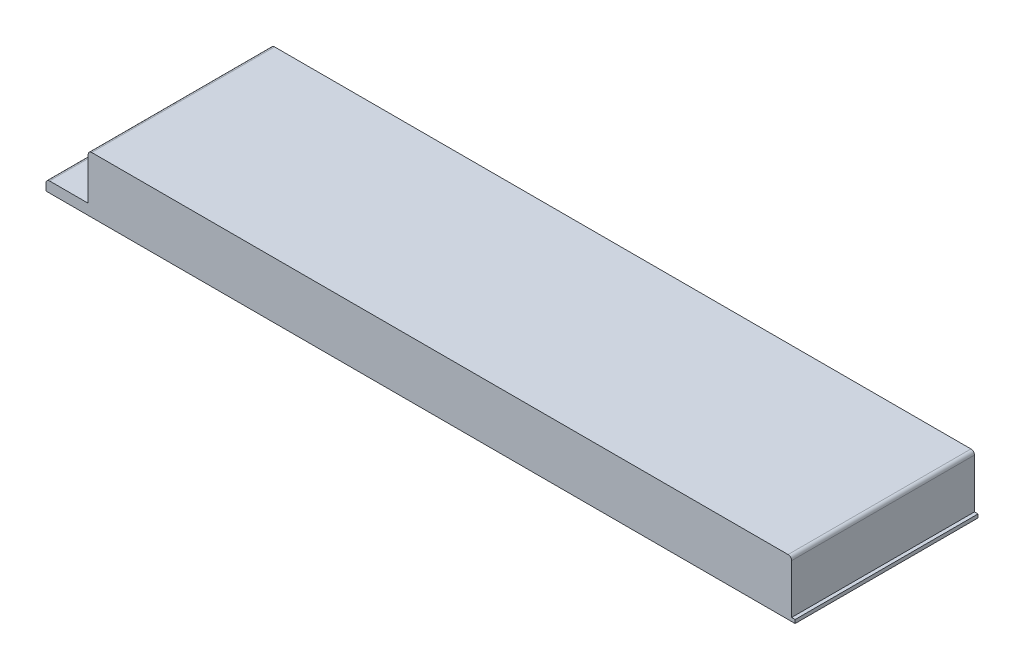
from build123d import *

# Parameters (mm, degrees)
SKETCH1_W                                           = 107
SKETCH1_H                                           = 26
BOSS_EXTRUDE1_DEPTH                                 = 8
SKETCH2_W                                           = 1
SKETCH2_H                                           = 7.5
SKETCH2_W_2                                         = 6
SKETCH2_H_2                                         = 6.5
CUT_EXTRUDE1_DEPTH                                  = 111.403804282
FILLET1_R                                           = 0.5
CSK_FOR_M2_COUNTERSUNK_FLAT_HEAD_SCREW1_D           = 2.4
CSK_FOR_M2_COUNTERSUNK_FLAT_HEAD_SCREW1_DEPTH       = 15
CSK_FOR_M2_COUNTERSUNK_FLAT_HEAD_SCREW1_CSINK_D     = 4.4
CSK_FOR_M2_COUNTERSUNK_FLAT_HEAD_SCREW1_CSINK_ANGLE = 90
CSK_FOR_M2_COUNTERSUNK_FLAT_HEAD_SCREW1_TIP         = 0.721032743
SKETCH14_W                                          = 97
SKETCH14_H                                          = 24
CUT_EXTRUDE7_DEPTH                                  = 111.403804282
SKETCH14_3_W                                        = 97
SKETCH14_3_H                                        = 24
BOSS_EXTRUDE3_DEPTH                                 = 1
SKETCH18_W                                          = 97
SKETCH18_H                                          = 24
CUT_EXTRUDE8_DEPTH                                  = 111.403804282
SKETCH20_W                                          = 97
SKETCH20_H                                          = 24
SKETCH20_W_2                                        = 93
SKETCH20_H_2                                        = 20
BOSS_EXTRUDE4_DEPTH                                 = 8
SKETCH20_2_W                                        = 97
SKETCH20_2_H                                        = 24
SKETCH20_2_W_2                                      = 93
SKETCH20_2_H_2                                      = 20
CUT_EXTRUDE9_DEPTH                                  = 3
SKETCH21_W                                          = 52
SKETCH21_H                                          = 2
BOSS_EXTRUDE5_DEPTH                                 = 5
SKETCH22_W                                          = 52
SKETCH22_H                                          = 2
BOSS_EXTRUDE6_DEPTH                                 = 5
SKETCH23_W                                          = 0.5
SKETCH23_H                                          = 16.612240618
CUT_EXTRUDE10_DEPTH                                 = 111.403804282
BOSS_EXTRUDE7_REACH                                 = 111.249
SKETCH25_W                                          = 2
SKETCH25_H                                          = 5
CUT_EXTRUDE11_REACH                                 = 64.258
SKETCH26_W                                          = 10
SKETCH26_H                                          = 2
SKETCH27_W                                          = 97
SKETCH27_H                                          = 24
BOSS_EXTRUDE8_DEPTH                                 = 3
SKETCH29_W                                          = 20
SKETCH29_H                                          = 5
CUT_EXTRUDE12_DEPTH                                 = 54


with BuildPart() as part:
    # Sketch1 → Boss-Extrude1 (new body)
    with BuildSketch(Plane(origin=(0, 0, 0), x_dir=(1, 0, 0), z_dir=(0, 1, 0))):
        with Locations((53.5, -13)):
            Rectangle(SKETCH1_W, SKETCH1_H)
    extrude(amount=BOSS_EXTRUDE1_DEPTH)

    # Sketch2 → Cut-Extrude1 (cut, through all)
    with BuildSketch(Plane.XY.offset(26)):
        with Locations((106.5, 4.25)):
            Rectangle(SKETCH2_W, SKETCH2_H)
        with Locations((3, 4.75)):
            Rectangle(SKETCH2_W_2, SKETCH2_H_2)
    extrude(amount=-CUT_EXTRUDE1_DEPTH, mode=Mode.SUBTRACT)

    # Fillet1
    fillet1_edges = [part.edges().sort_by_distance(p)[0] for p in [
        (106, 8, 13),
        (0, 1.5, 13),
        (6, 8, 13),
    ]]
    fillet(fillet1_edges, radius=FILLET1_R)

    # CSK for M2 Countersunk Flat Head Screw1
    with Locations(Plane(origin=(3, 1.5, 13), x_dir=(1, 0, 0), z_dir=(0, 1, 0))):
        with Locations((0, 0)):
            CounterSinkHole(CSK_FOR_M2_COUNTERSUNK_FLAT_HEAD_SCREW1_D / 2, CSK_FOR_M2_COUNTERSUNK_FLAT_HEAD_SCREW1_CSINK_D / 2, depth=CSK_FOR_M2_COUNTERSUNK_FLAT_HEAD_SCREW1_DEPTH, counter_sink_angle=CSK_FOR_M2_COUNTERSUNK_FLAT_HEAD_SCREW1_CSINK_ANGLE)
            with Locations((0, 0, -(CSK_FOR_M2_COUNTERSUNK_FLAT_HEAD_SCREW1_DEPTH + CSK_FOR_M2_COUNTERSUNK_FLAT_HEAD_SCREW1_TIP / 2))):  # 118° drill point
                Cone(0, CSK_FOR_M2_COUNTERSUNK_FLAT_HEAD_SCREW1_D / 2, CSK_FOR_M2_COUNTERSUNK_FLAT_HEAD_SCREW1_TIP, mode=Mode.SUBTRACT)

    # Sketch14 → Cut-Extrude7 (cut, through all)
    with BuildSketch(Plane(origin=(0, 8, 0), x_dir=(1, 0, 0), z_dir=(0, 1, 0))):
        with Locations((56, -13)):
            Rectangle(SKETCH14_W, SKETCH14_H)
    extrude(amount=-CUT_EXTRUDE7_DEPTH, mode=Mode.SUBTRACT)

    # Sketch14<3> → Boss-Extrude3 (add)
    with BuildSketch(Plane(origin=(0, 8, 0), x_dir=(1, 0, 0), z_dir=(0, 1, 0))):
        with Locations((56, -13)):
            Rectangle(SKETCH14_3_W, SKETCH14_3_H)
    extrude(amount=-BOSS_EXTRUDE3_DEPTH)

    # Sketch18 → Cut-Extrude8 (cut, through all)
    with BuildSketch(Plane(origin=(0, 0, 0), x_dir=(1, 0, 0), z_dir=(0, 1, 0))):
        with Locations((56, -13)):
            Rectangle(SKETCH18_W, SKETCH18_H)
    extrude(amount=CUT_EXTRUDE8_DEPTH, mode=Mode.SUBTRACT)

    # Sketch20 → Boss-Extrude4 (add)
    with BuildSketch(Plane(origin=(0, 8, 0), x_dir=(1, 0, 0), z_dir=(0, 1, 0))):
        with Locations((56, -13)):
            Rectangle(SKETCH20_W, SKETCH20_H)
        with Locations((56, -13)):
            Rectangle(SKETCH20_W_2, SKETCH20_H_2, mode=Mode.SUBTRACT)
    extrude(amount=-BOSS_EXTRUDE4_DEPTH)

    # Sketch20<2> → Cut-Extrude9 (cut)
    with BuildSketch(Plane(origin=(0, 8, 0), x_dir=(1, 0, 0), z_dir=(0, 1, 0))):
        with Locations((56, -13)):
            Rectangle(SKETCH20_2_W, SKETCH20_2_H)
        with Locations((56, -13)):
            Rectangle(SKETCH20_2_W_2, SKETCH20_2_H_2, mode=Mode.SUBTRACT)
    extrude(amount=-CUT_EXTRUDE9_DEPTH, mode=Mode.SUBTRACT)

    # Sketch21 → Boss-Extrude5 (add)
    with BuildSketch(Plane.XY.offset(3)):
        with Locations((76.5, 1)):
            Rectangle(SKETCH21_W, SKETCH21_H)
    extrude(amount=BOSS_EXTRUDE5_DEPTH)

    # Sketch22 → Boss-Extrude6 (add)
    with BuildSketch(Plane(origin=(0, 0, 23), x_dir=(-1, 0, 0), z_dir=(0, 0, -1))):
        with Locations((-76.5, 1)):
            Rectangle(SKETCH22_W, SKETCH22_H)
    extrude(amount=BOSS_EXTRUDE6_DEPTH)

    # Sketch23 → Cut-Extrude10 (cut, through all)
    with BuildSketch(Plane.XY.offset(26)):
        with Locations((106.75, 8.306120309)):
            Rectangle(SKETCH23_W, SKETCH23_H)
    extrude(amount=-CUT_EXTRUDE10_DEPTH, mode=Mode.SUBTRACT)

    # Sketch25 → Boss-Extrude7 (add, up to next)
    with BuildSketch(Plane(origin=(0, 0, 23), x_dir=(-1, 0, 0), z_dir=(0, 0, -1)), mode=Mode.PRIVATE) as boss_extrude7_sk1:
        with Locations((-49.5, 2.5)):
            Rectangle(SKETCH25_W, SKETCH25_H)
    boss_extrude7_tool1 = extrude(boss_extrude7_sk1.sketch, amount=BOSS_EXTRUDE7_REACH, mode=Mode.PRIVATE) - part.part
    add(boss_extrude7_tool1.solids().sort_by_distance((49.5, 2.5, 23))[0])

    # Sketch26 → Cut-Extrude11 (cut, up to next)
    with BuildSketch(Plane(origin=(50.5, 0, 0), x_dir=(0, 0, -1), z_dir=(1, 0, 0)), mode=Mode.PRIVATE) as cut_extrude11_sk1:
        with Locations((-13, 1)):
            Rectangle(SKETCH26_W, SKETCH26_H)
    cut_extrude11_tool1 = extrude(cut_extrude11_sk1.sketch, amount=-CUT_EXTRUDE11_REACH, mode=Mode.PRIVATE) & part.part
    add(cut_extrude11_tool1.solids().sort_by_distance((50.5, 1, 13))[0], mode=Mode.SUBTRACT)

    # Sketch27 → Boss-Extrude8 (add)
    with BuildSketch(Plane(origin=(0, 5, 0), x_dir=(1, 0, 0), z_dir=(0, 1, 0))):
        with Locations((56, -13)):
            Rectangle(SKETCH27_W, SKETCH27_H)
    extrude(amount=BOSS_EXTRUDE8_DEPTH)

    # Sketch29 → Cut-Extrude12 (cut)
    with BuildSketch(Plane.ZY.offset(-48.5)):
        with Locations((13, 2.5)):
            Rectangle(SKETCH29_W, SKETCH29_H)
    extrude(amount=-CUT_EXTRUDE12_DEPTH, mode=Mode.SUBTRACT)


solid = part.part
